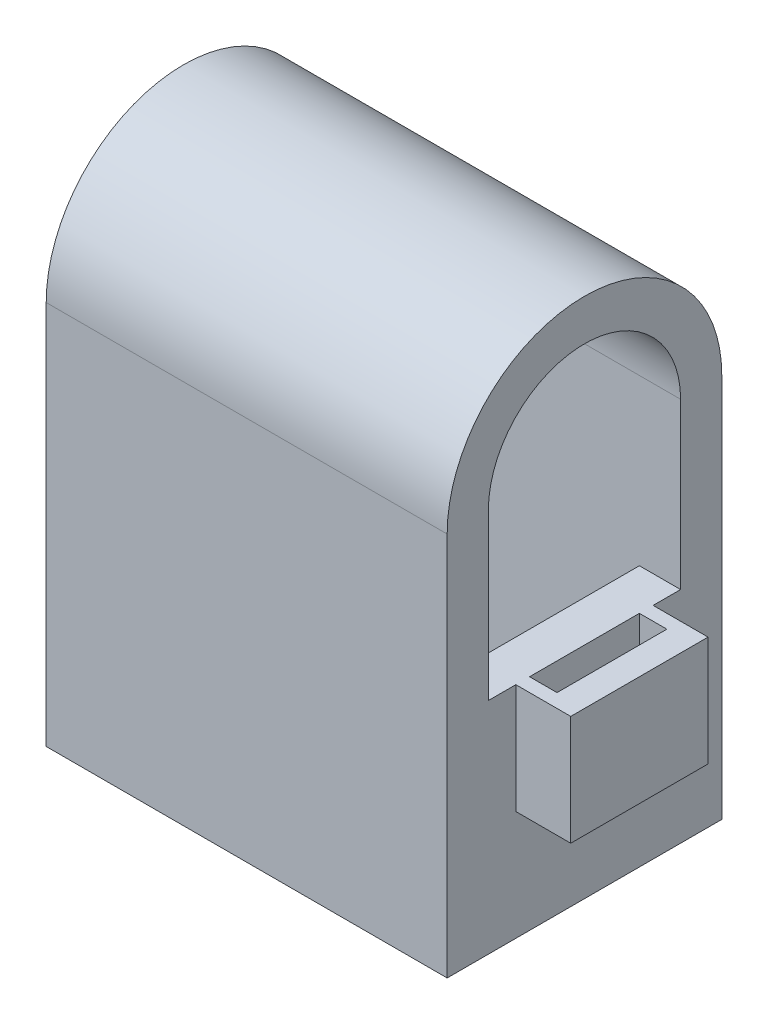
from build123d import *

# Parameters (mm, degrees)
SKETCH1_W           = 18.542
SKETCH1_H           = 17.78
BOSS_EXTRUDE4_DEPTH = 1.905
SKETCH4_W           = 18.542
SKETCH4_H           = 17.78
BOSS_EXTRUDE5_DEPTH = 1.905
BOSS_EXTRUDE6_DEPTH = 18.542
SKETCH7_W           = 8.89
SKETCH7_H           = 10.16
BOSS_EXTRUDE7_DEPTH = 1.905
SKETCH8_W           = 8.89
SKETCH8_H           = 10.16
BOSS_EXTRUDE8_DEPTH = 1.905
SKETCH9_W           = 6.35
SKETCH9_H           = 5.08
BOSS_EXTRUDE9_DEPTH = 2.54
SKETCH10_W          = 1.27
SKETCH10_H          = 5.08
CUT_EXTRUDE1_DEPTH  = 23.269948832


with BuildPart() as part:
    # Sketch1 → Boss-Extrude4 (new body)
    with BuildSketch(Plane.XY):
        Rectangle(SKETCH1_W, SKETCH1_H)
    extrude(amount=-BOSS_EXTRUDE4_DEPTH)



with BuildPart() as body_2:
    # Sketch4 → Boss-Extrude5 (new body)
    with BuildSketch(Plane.XY.offset(-12.7)):
        Rectangle(SKETCH4_W, SKETCH4_H)
    extrude(amount=BOSS_EXTRUDE5_DEPTH)


with BuildPart() as part_1:
    add(part.part)

    add(body_2.part)  # Boss-Extrude6 merges body 2
    # Sketch6 → Boss-Extrude6 (add)
    with BuildSketch(Plane.ZY.offset(9.271)):
        with BuildLine():
            Line((-12.7, 8.89), (-10.795, 8.89))
            ThreePointArc((-10.795, 8.89), (-6.35, 13.335), (-1.905, 8.89))
            Line((-1.905, 8.89), (0, 8.89))
            ThreePointArc((0, 8.89), (-6.35, 15.24), (-12.7, 8.89))
        make_face()
    extrude(amount=-BOSS_EXTRUDE6_DEPTH)

    # Sketch7 → Boss-Extrude7 (add)
    with BuildSketch(Plane.ZY.offset(9.271)):
        with Locations((-6.35, -3.81)):
            Rectangle(SKETCH7_W, SKETCH7_H)
    extrude(amount=-BOSS_EXTRUDE7_DEPTH)

    # Sketch8 → Boss-Extrude8 (add)
    with BuildSketch(Plane(origin=(9.271, 0, 0), x_dir=(0, 0, -1), z_dir=(1, 0, 0))):
        with Locations((6.35, -3.81)):
            Rectangle(SKETCH8_W, SKETCH8_H)
    extrude(amount=-BOSS_EXTRUDE8_DEPTH)

    # Sketch9 → Boss-Extrude9 (add)
    with BuildSketch(Plane(origin=(9.271, 0, 0), x_dir=(0, 0, -1), z_dir=(1, 0, 0))):
        with Locations((6.35, -1.27)):
            Rectangle(SKETCH9_W, SKETCH9_H)
    extrude(amount=BOSS_EXTRUDE9_DEPTH)

    # Sketch10 → Cut-Extrude1 (cut, through all)
    with BuildSketch(Plane(origin=(0, 1.27, 0), x_dir=(1, 0, 0), z_dir=(0, 1, 0))):
        with Locations((9.906, 6.35)):
            Rectangle(SKETCH10_W, SKETCH10_H)
    extrude(amount=-CUT_EXTRUDE1_DEPTH, mode=Mode.SUBTRACT)


solid = part_1.part
